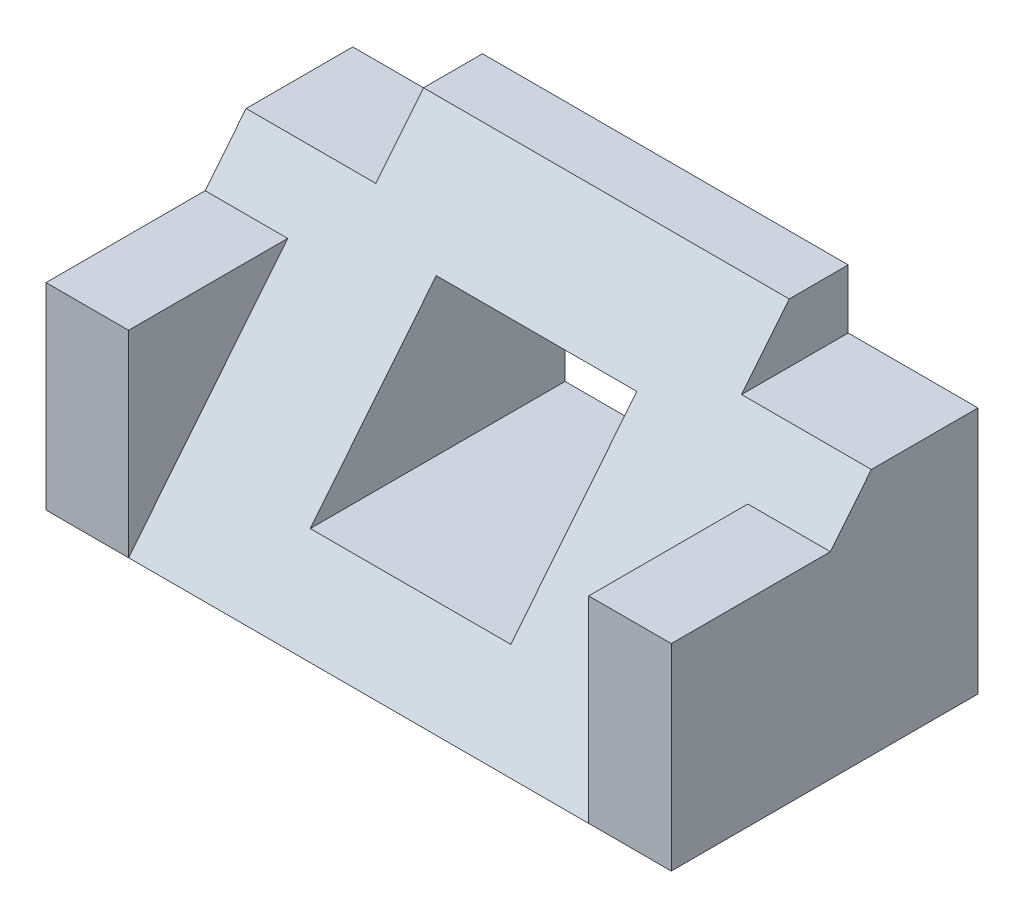
from build123d import *

# Parameters (mm, degrees)
ESQUISSE1_W             = 26
ESQUISSE1_H             = 26
BOSS_EXTRU_1_DEPTH      = 26.5
ENL_V_MAT_EXTRU_1_DEPTH = 19.5
ESQUISSE4_W             = 11
ESQUISSE4_H             = 10
ENL_V_MAT_EXTRU_2_DEPTH = 40.33509883
ENL_V_MAT_EXTRU_3_DEPTH = 57.098128311
ESQUISSE6_W             = 17
ESQUISSE6_H             = 17
ENL_V_MAT_EXTRU_4_DEPTH = 44.211248008


with BuildPart() as part:
    # Esquisse1 → Boss.-Extru.1 (new, symmetric)
    with BuildSketch(Plane(origin=(0, 0, 0), x_dir=(0, 0, -1), z_dir=(1, 0, 0))):
        Rectangle(ESQUISSE1_W, ESQUISSE1_H)
    extrude(amount=BOSS_EXTRU_1_DEPTH, both=True)

    # Esquisse3 → Enlèv. mat.-Extru.1 (cut, symmetric)
    with BuildSketch(Plane(origin=(0, 0, 0), x_dir=(0, 0, -1), z_dir=(1, 0, 0))):
        Polygon((-13, -13), (8, 13), (-13, 13), align=None)
    extrude(amount=ENL_V_MAT_EXTRU_1_DEPTH, both=True, mode=Mode.SUBTRACT)

    # Esquisse4 → Enlèv. mat.-Extru.2 (cut, through all)
    with BuildSketch(Plane.XY.offset(13)):
        with Locations((21, 13)):
            Rectangle(ESQUISSE4_W, ESQUISSE4_H)
    enl_v_mat_extru_2 = extrude(amount=-ENL_V_MAT_EXTRU_2_DEPTH, mode=Mode.SUBTRACT)

    # Symétrie1: Enlèv. mat.-Extru.2 across plane
    add(enl_v_mat_extru_2.mirror(Plane(origin=(0, 0, 0), x_dir=(0, 0, 1), z_dir=(1, 0, 0))), mode=Mode.SUBTRACT)

    # Esquisse5 → Enlèv. mat.-Extru.3 (cut, through all)
    with BuildSketch(Plane(origin=(26.5, 0, 0), x_dir=(0, 0, -1), z_dir=(1, 0, 0))):
        Polygon((-13, 3.7), (0.488461538, 3.7), (3.961538462, 8), (-13, 8), align=None)
    extrude(amount=-ENL_V_MAT_EXTRU_3_DEPTH, mode=Mode.SUBTRACT)

    # Esquisse6 → Enlèv. mat.-Extru.4 (cut, through all, along a direction that is not the sketch's normal)
    with BuildSketch(Plane(origin=(0, 1.222023277, 1.5129812), x_dir=(1, 0, 0), z_dir=(0, 0.6283371070876215, 0.7779411802037214))):
        with Locations((0, -2.781617735)):
            Rectangle(ESQUISSE6_W, ESQUISSE6_H)
    extrude(amount=-ENL_V_MAT_EXTRU_4_DEPTH, dir=(0, 0, 1), mode=Mode.SUBTRACT)


solid = part.part
